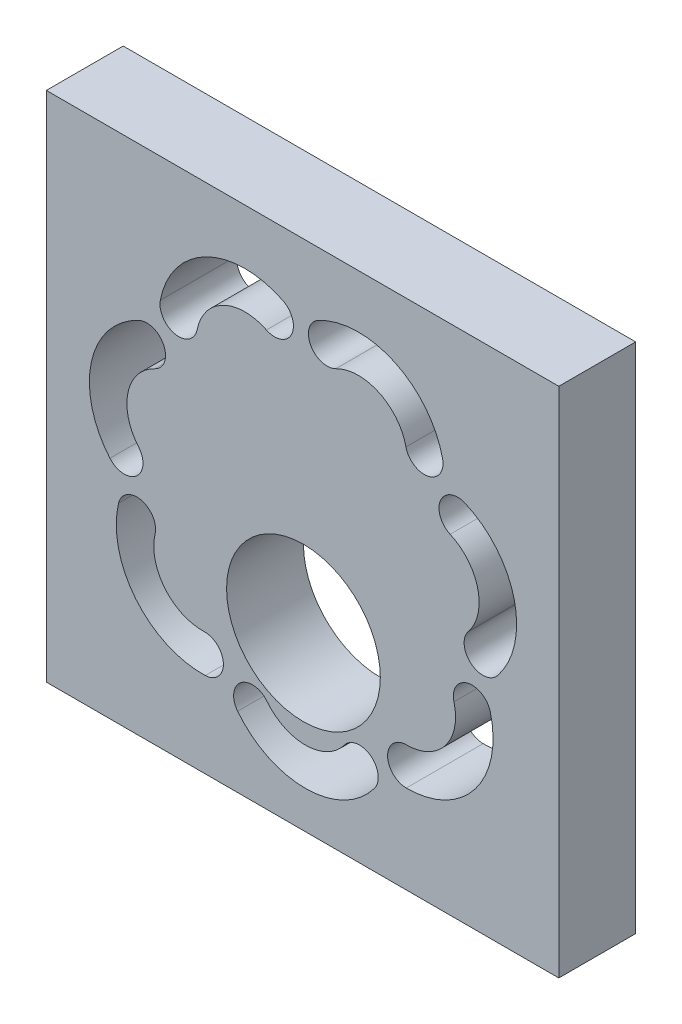
from build123d import *

# Parameters (mm, degrees)
SKETCH1_W           = 40
SKETCH1_H           = 40
BOSS_EXTRUDE1_DEPTH = 6
SKETCH3_R           = 6
CUT_EXTRUDE1_DEPTH  = 29.956627751


with BuildPart() as part:
    # Sketch1 → Boss-Extrude1 (new body)
    with BuildSketch(Plane.XY):
        with Locations((-0.03035818, 0.031750845)):
            Rectangle(SKETCH1_W, SKETCH1_H)
    extrude(amount=BOSS_EXTRUDE1_DEPTH)

    # Sketch3 → Cut-Extrude1 (cut, through all)
    with BuildSketch(Plane.XY):
        with Locations((0.03811678, -6.611407744)):
            Circle(SKETCH3_R)
        with BuildLine():
            ThreePointArc((-1.563550895, 15.055123875), (-7.521124365, 15.038743131), (-11.132245635, 10.300309513))
            ThreePointArc((-11.132245635, 10.300309513), (-9.975977933, 8.583173649), (-8.258842069, 9.739441351))
            ThreePointArc((-8.258842069, 9.739441351), (-6.218325676, 12.416961919), (-2.851912471, 12.426218095))
            ThreePointArc((-2.851912471, 12.426218095), (-0.893278793, 13.096490197), (-1.563550895, 15.055123875))
        make_face()
        with BuildLine():
            ThreePointArc((10.897165218, 10.597004263), (7.169871935, 15.244609534), (1.213718069, 15.113532793))
            ThreePointArc((1.213718069, 15.113532793), (0.592128311, 13.138909601), (2.566751502, 12.517319844))
            ThreePointArc((2.566751502, 12.517319844), (5.932362539, 12.591386656), (8.038523611, 9.965189961))
            ThreePointArc((8.038523611, 9.965189961), (9.783751566, 8.851776308), (10.897165218, 10.597004263))
        make_face()
        with BuildLine():
            ThreePointArc((15.180796373, -1.924768002), (16.490511142, 3.887081721), (12.674430025, 8.462065316))
            ThreePointArc((12.674430025, 8.462065316), (10.743052573, 7.716886336), (11.488231553, 5.785508884))
            ThreePointArc((11.488231553, 5.785508884), (13.644563477, 3.20034812), (12.904490171, -0.083721771))
            ThreePointArc((12.904490171, -0.083721771), (13.122120157, -2.142397987), (15.180796373, -1.924768002))
        make_face()
        with BuildLine():
            ThreePointArc((8.06168094, -13.081043006), (13.422161827, -10.481390213), (14.619740374, -4.645402241))
            ThreePointArc((14.619740374, -4.645402241), (12.832941842, -3.60000204), (11.78754164, -5.386800572))
            ThreePointArc((11.78754164, -5.386800572), (11.110832531, -8.684510129), (8.081815142, -10.153481604))
            ThreePointArc((8.081815142, -10.153481604), (6.60796734, -11.607195205), (8.06168094, -13.081043006))
        make_face()
        with BuildLine():
            ThreePointArc((-5.099341956, -14.470918126), (0.275353607, -17.041053839), (5.584790746, -14.338679466))
            ThreePointArc((5.584790746, -14.338679466), (5.288066872, -12.289907756), (3.239295163, -12.586631629))
            ThreePointArc((3.239295163, -12.586631629), (0.239120783, -14.113647422), (-2.797928816, -12.661355))
            ThreePointArc((-2.797928816, -12.661355), (-4.853416949, -12.415429993), (-5.099341956, -14.470918126))
        make_face()
        with BuildLine():
            ThreePointArc((-14.391753639, -5.047789047), (-13.050098782, -10.852348653), (-7.62691751, -13.3185309))
            ThreePointArc((-7.62691751, -13.3185309), (-6.210127596, -11.809154567), (-7.719503929, -10.392364653))
            ThreePointArc((-7.719503929, -10.392364653), (-10.783951079, -8.998812644), (-11.542072595, -5.718862139))
            ThreePointArc((-11.542072595, -5.718862139), (-12.63137657, -3.958485071), (-14.391753639, -5.047789047))
        make_face()
        with BuildLine():
            ThreePointArc((-12.81817858, 8.092535837), (-16.519857902, 3.424504113), (-15.066698607, -2.353149221))
            ThreePointArc((-15.066698607, -2.353149221), (-13.003266608, -2.519759429), (-12.8366564, -0.456327431))
            ThreePointArc((-12.8366564, -0.456327431), (-13.657785113, 2.808419294), (-11.566097582, 5.446158252))
            ThreePointArc((-11.566097582, 5.446158252), (-10.868949288, 7.395387544), (-12.81817858, 8.092535837))
        make_face()
    extrude(amount=CUT_EXTRUDE1_DEPTH, mode=Mode.SUBTRACT)


solid = part.part
